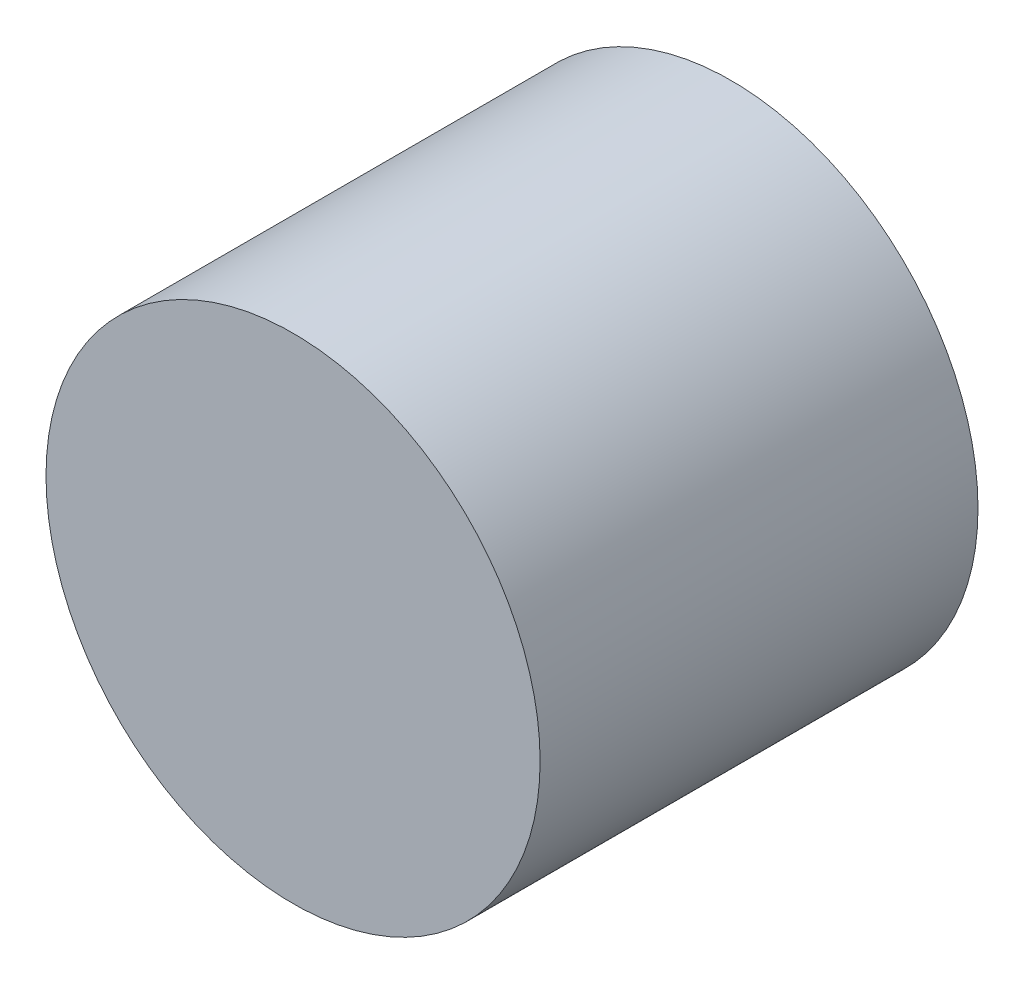
from build123d import *

# Parameters (mm, degrees)
SKETCH1_R           = 12.6111
BOSS_EXTRUDE1_DEPTH = 22.352


with BuildPart() as part:
    # Sketch1 → Boss-Extrude1 (new body)
    with BuildSketch(Plane(origin=(0, 0, 0), x_dir=(0, 1, 0), z_dir=(0, 0, 1))):
        with Locations(Location((0, 0, 0), (0, 0, 270))):
            Circle(SKETCH1_R)
    extrude(amount=BOSS_EXTRUDE1_DEPTH)


solid = part.part
